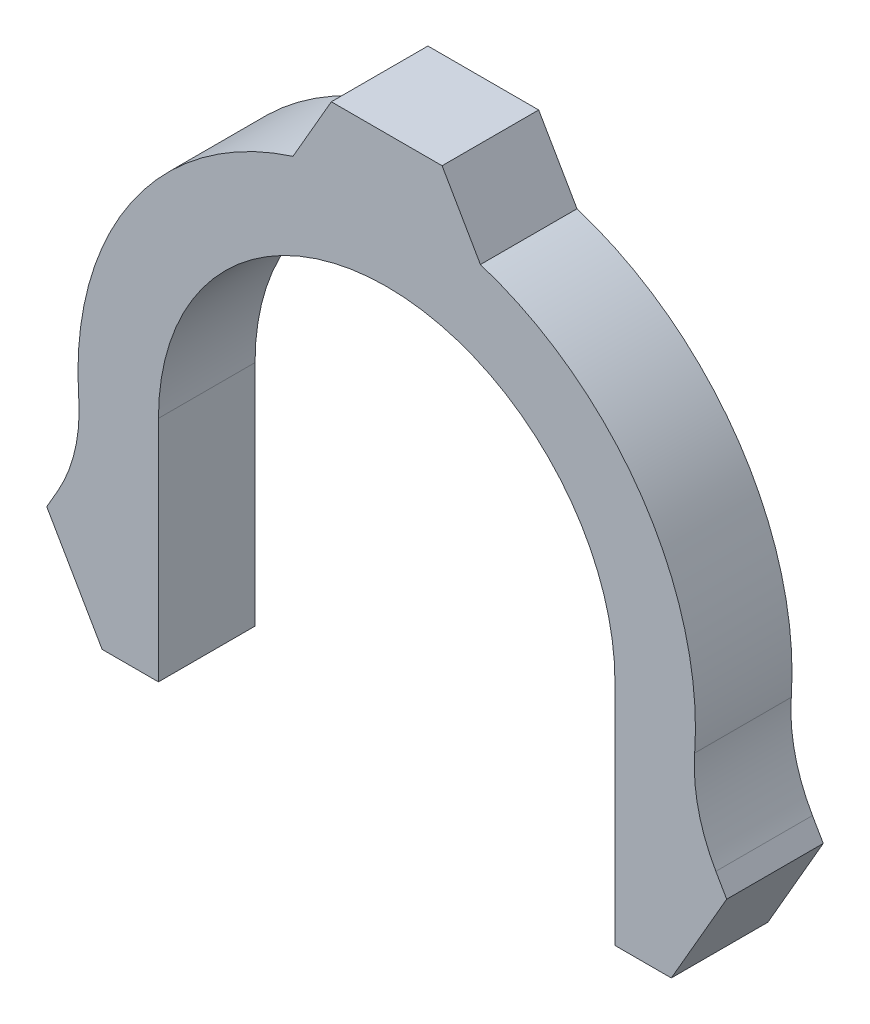
from build123d import *

# Parameters (mm, degrees)
BOSS_EXTRUDE1_DEPTH = 12
CUT_EXTRUDE1_DEPTH  = 12


with BuildPart() as part:
    # Sketch1 → Boss-Extrude1 (new body)
    with BuildSketch(Plane.XY):
        with BuildLine():
            Line((-45.137913667, 106.817655073), (-56.782603372, 86.648460865))
            ThreePointArc((-56.782603372, 86.648460865), (-76.884990379, 71.629544832), (-83.401578598, 47.397172266))
            ThreePointArc((-83.401578598, 47.397172266), (-83.862908864, 41.49589237), (-86.031372169, 35.98810725))
            Line((-86.031372169, 35.98810725), (-94.257114543, 21.740703527))
            Line((-94.257114543, 21.740703527), (-73.496897515, 21.740703527))
            Line((-73.496897515, 21.740703527), (-73.496897515, 50.099687376))
            ThreePointArc((-73.496897515, 50.099687376), (-45.137913667, 78.458671224), (-16.778929818, 50.099687376))
            Line((-16.778929818, 50.099687376), (-16.778929818, 21.740703527))
            Line((-16.778929818, 21.740703527), (3.98128721, 21.740703527))
            Line((3.98128721, 21.740703527), (-4.244455165, 35.98810725))
            ThreePointArc((-4.244455165, 35.98810725), (-6.412918469, 41.49589237), (-6.874248735, 47.397172266))
            ThreePointArc((-6.874248735, 47.397172266), (-13.390836954, 71.629544832), (-33.493223961, 86.648460865))
            Line((-33.493223961, 86.648460865), (-45.137913667, 106.817655073))
        make_face()
    extrude(amount=BOSS_EXTRUDE1_DEPTH)

    # Sketch2 → Cut-Extrude1 (cut)
    with BuildSketch(Plane.XY.offset(12)):
        Polygon((-52.018755525, 94.899687376), (-38.257071808, 94.899687376), (-45.137913667, 106.817655073), align=None)
        Polygon((-80.495430827, 21.740703527), (-87.376272685, 33.658671224), (-94.257114543, 21.740703527), align=None)
        Polygon((-2.899554648, 33.658671224), (-9.780396506, 21.740703527), (3.98128721, 21.740703527), align=None)
    extrude(amount=-CUT_EXTRUDE1_DEPTH, mode=Mode.SUBTRACT)


solid = part.part
